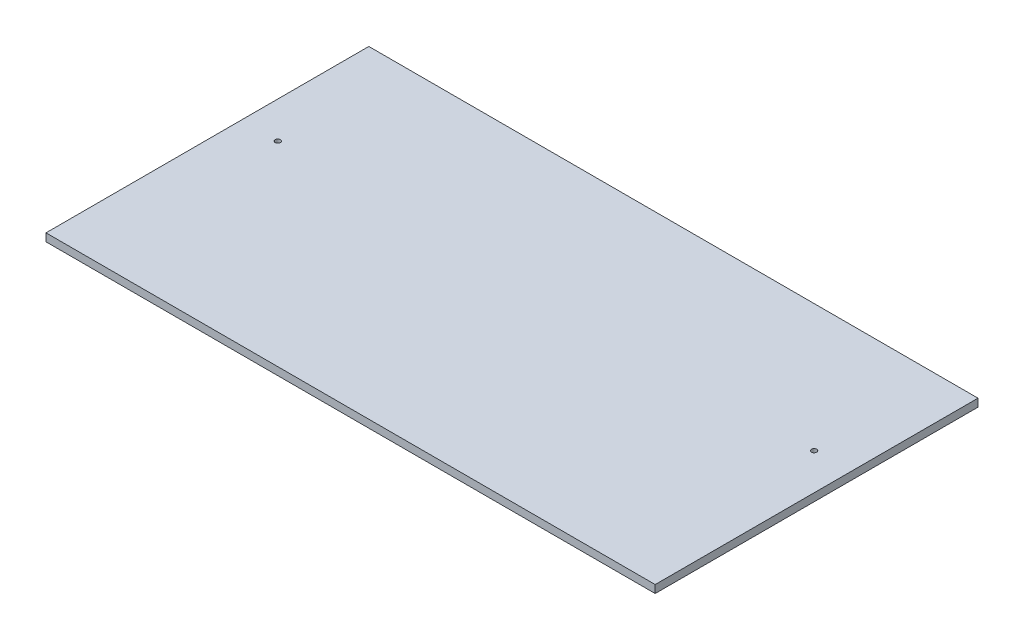
from build123d import *

# Parameters (mm, degrees)
SKETCH1_W           = 742.95
SKETCH1_H           = 393.7
BOSS_EXTRUDE1_DEPTH = 9.525
SKETCH3_R           = 3.175
CUT_EXTRUDE3_DEPTH  = 421.516734209


with BuildPart() as part:
    # Sketch1 → Boss-Extrude1 (new body)
    with BuildSketch(Plane(origin=(0, 0, 0), x_dir=(1, 0, 0), z_dir=(0, 1, 0))):
        Rectangle(SKETCH1_W, SKETCH1_H)
    extrude(amount=BOSS_EXTRUDE1_DEPTH)

    # Sketch3 → Cut-Extrude3 (cut, through all)
    with BuildSketch(Plane(origin=(0, 9.525, 0), x_dir=(1, 0, 0), z_dir=(0, 1, 0))):
        with Locations(Location((-327.025, 41.402, 0), (0, 0, 270))):
            Circle(SKETCH3_R)
        with Locations(Location((327.025, 41.402, 0), (0, 0, 270))):
            Circle(SKETCH3_R)
    extrude(amount=-CUT_EXTRUDE3_DEPTH, mode=Mode.SUBTRACT)


solid = part.part
